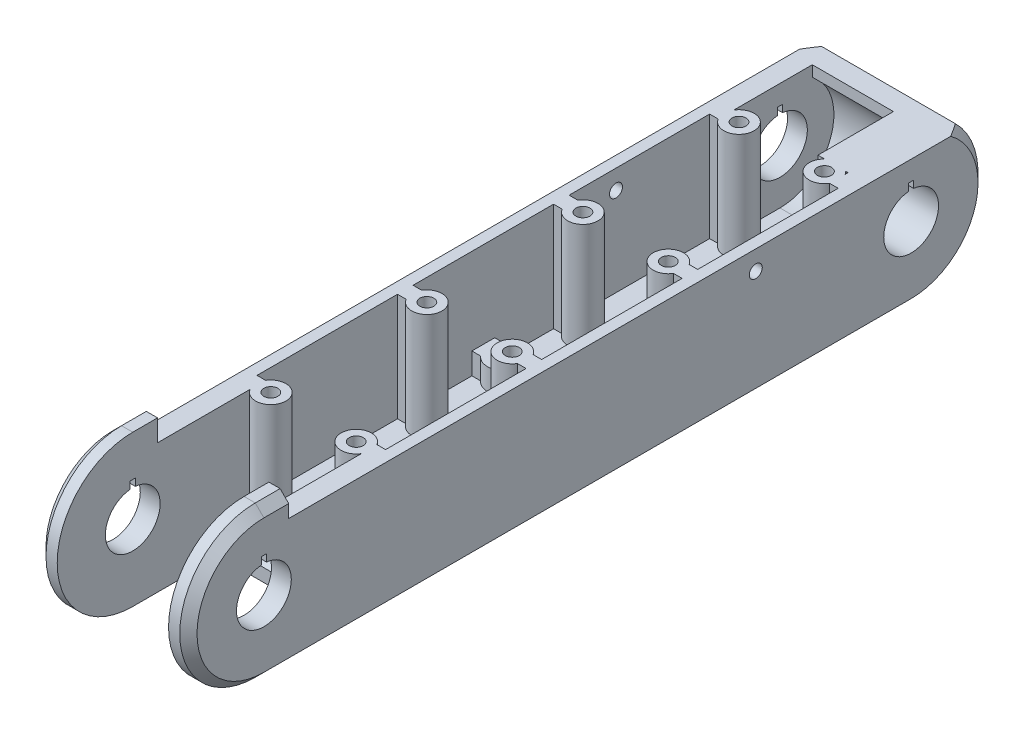
from build123d import *

# Parameters (mm, degrees)
SKETCH1_R           = 6.35
BOSS_EXTRUDE1_DEPTH = 17.5
CUT_EXTRUDE1_DEPTH  = 12.9
CHAMFER1_SIZE       = 2
SKETCH4_R           = 3.5
BOSS_EXTRUDE2_DEPTH = 25
SKETCH8_R           = 1.625
CUT_EXTRUDE4_DEPTH  = 30
SKETCH7_R           = 2.2
CUT_EXTRUDE3_DEPTH  = 4.5
SKETCH9_R           = 4
SKETCH9_R_2         = 1.625
BOSS_EXTRUDE3_DEPTH = 5
SKETCH11_R          = 2.75
CUT_EXTRUDE5_DEPTH  = 3
SKETCH12_R          = 1.625
CUT_EXTRUDE6_DEPTH  = 101.436547133
CUT_EXTRUDE8_REACH  = 100.805
SKETCH15_W          = 2
SKETCH15_H          = 32.561115391
SKETCH15_H_2        = 13.634806385
SKETCH16_W          = 2
SKETCH16_H          = 5.291502622
CUT_EXTRUDE9_DEPTH  = 20
CUT_EXTRUDE10_REACH = 102.437
SKETCH17_R          = 1.5
CUT_EXTRUDE11_REACH = 102.437
SKETCH18_W          = 1.2
SKETCH18_H          = 8
SKETCH19_W          = 20
SKETCH19_H          = 25
BOSS_EXTRUDE4_DEPTH = 7
CUT_EXTRUDE12_DEPTH = 35


with BuildPart() as part:
    # Sketch1 → Boss-Extrude1 (new, symmetric)
    with BuildSketch(Plane(origin=(0, 0, 0), x_dir=(0, 0, -1), z_dir=(1, 0, 0))):
        with BuildLine():
            Line((-75, -17.5), (75, -17.5))
            ThreePointArc((75, -17.5), (91.201851746, -6.614378278), (87.247448714, 12.5))
            Line((87.247448714, 12.5), (-69.247448714, 12.5))
            Line((-69.247448714, 12.5), (-69.247448714, 17.5))
            Line((-69.247448714, 17.5), (-75, 17.5))
            ThreePointArc((-75, 17.5), (-92.5, 0), (-75, -17.5))
        make_face()
        with Locations((-75, 0)):
            Circle(SKETCH1_R, mode=Mode.SUBTRACT)
        with Locations((75, 0)):
            Circle(SKETCH1_R, mode=Mode.SUBTRACT)
    extrude(amount=BOSS_EXTRUDE1_DEPTH, both=True)

    # Sketch3 → Cut-Extrude1 (cut, symmetric)
    with BuildSketch(Plane(origin=(0, 0, 0), x_dir=(0, 0, -1), z_dir=(1, 0, 0))):
        with BuildLine():
            Line((-55, -12.5), (75, -12.5))
            ThreePointArc((75, -12.5), (86.858541226, -3.952847075), (82.5, 10))
            Line((82.5, 10), (82.5, 17.5))
            Line((82.5, 17.5), (-92.5, 17.5))
            Line((-92.5, 17.5), (-92.5, -17.5))
            Line((-92.5, -17.5), (-55, -17.5))
            Line((-55, -17.5), (-55, -12.5))
        make_face()
    extrude(amount=CUT_EXTRUDE1_DEPTH, both=True, mode=Mode.SUBTRACT)

    # Chamfer1
    chamfer1_edges = [part.edges().sort_by_distance(p)[0] for p in [
        (17.5, -6.614378278, -91.201851746),
        (17.5, 17.5, 72.123724357),
        (0, -12.5, 55),
        (17.5, 0, 92.5),
        (-17.5, 17.5, 72.123724357),
        (-17.5, -6.614378278, -91.201851746),
        (-17.5, -17.5, 0),
        (-17.5, 0, 92.5),
        (17.5, -17.5, 0),
    ]]
    chamfer(chamfer1_edges, length=CHAMFER1_SIZE)

    # Sketch4 → Boss-Extrude2 (add)
    with BuildSketch(Plane(origin=(0, -12.5, 0), x_dir=(1, 0, 0), z_dir=(0, 1, 0))):
        with Locations((-9.9, 62.5)):
            Circle(SKETCH4_R)
        with Locations((-9.9, 26.333333333)):
            Circle(SKETCH4_R)
        with Locations((-9.9, -9.833333333)):
            Circle(SKETCH4_R)
        with Locations((-9.9, -46)):
            Circle(SKETCH4_R)
    boss_extrude2 = extrude(amount=BOSS_EXTRUDE2_DEPTH)

    # Sketch8 → Cut-Extrude4 (cut)
    with BuildSketch(Plane(origin=(0, 12.5, 0), x_dir=(1, 0, 0), z_dir=(0, 1, 0))):
        with Locations(Location((-9.9, 62.5, 0), (0, 0, 270))):
            Circle(SKETCH8_R)
        with Locations(Location((-9.9, 26.333333333, 0), (0, 0, 270))):
            Circle(SKETCH8_R)
        with Locations(Location((-9.9, -9.833333333, 0), (0, 0, 270))):
            Circle(SKETCH8_R)
        with Locations(Location((-9.9, -46, 0), (0, 0, 270))):
            Circle(SKETCH8_R)
    cut_extrude4 = extrude(amount=-CUT_EXTRUDE4_DEPTH, mode=Mode.SUBTRACT)

    # Sketch7 → Cut-Extrude3 (cut)
    with BuildSketch(Plane.XZ.offset(17.5)):
        with Locations(Location((-9.9, 46, 0), (0, 0, 270))):
            Circle(SKETCH7_R)
        with Locations(Location((-9.9, 9.833333333, 0), (0, 0, 270))):
            Circle(SKETCH7_R)
        with Locations(Location((-9.9, -26.333333333, 0), (0, 0, 270))):
            Circle(SKETCH7_R)
        with Locations(Location((-9.9, -62.5, 0), (0, 0, 270))):
            Circle(SKETCH7_R)
    cut_extrude3 = extrude(amount=-CUT_EXTRUDE3_DEPTH, mode=Mode.SUBTRACT)

    # Sketch9 → Boss-Extrude3 (add, symmetric)
    with BuildSketch(Plane(origin=(0, -12.5, 0), x_dir=(1, 0, 0), z_dir=(0, 1, 0))):
        with Locations((-9.9, 8.25)):
            Circle(SKETCH9_R)
        with Locations(Location((-9.9, 8.25, 0), (0, 0, 270))):
            Circle(SKETCH9_R_2, mode=Mode.SUBTRACT)
    boss_extrude3 = extrude(amount=BOSS_EXTRUDE3_DEPTH, both=True)

    # Sketch11 → Cut-Extrude5 (cut)
    with BuildSketch(Plane.XZ.offset(17.5)):
        with Locations(Location((-9.9, -8.25, 0), (0, 0, 270))):
            Circle(SKETCH11_R)
    cut_extrude5 = extrude(amount=-CUT_EXTRUDE5_DEPTH, mode=Mode.SUBTRACT)

    # Mirror1: Boss-Extrude2, Cut-Extrude4, Cut-Extrude3, Boss-Extrude3, Cut-Extrude5 across plane
    add(boss_extrude2.mirror(Plane(origin=(0, 0, 0), x_dir=(0, 0, 1), z_dir=(1, 0, 0))))
    add(cut_extrude4.mirror(Plane(origin=(0, 0, 0), x_dir=(0, 0, 1), z_dir=(1, 0, 0))), mode=Mode.SUBTRACT)
    add(cut_extrude3.mirror(Plane(origin=(0, 0, 0), x_dir=(0, 0, 1), z_dir=(1, 0, 0))), mode=Mode.SUBTRACT)
    add(boss_extrude3.mirror(Plane(origin=(0, 0, 0), x_dir=(0, 0, 1), z_dir=(1, 0, 0))))
    add(cut_extrude5.mirror(Plane(origin=(0, 0, 0), x_dir=(0, 0, 1), z_dir=(1, 0, 0))), mode=Mode.SUBTRACT)

    # Sketch12 → Cut-Extrude6 (cut, symmetric)
    with BuildSketch(Plane.XZ.offset(17.5)):
        with Locations(Location((9.9, -8.25, 0), (0, 0, 90))):
            Circle(SKETCH12_R)
    cut_extrude6 = extrude(amount=CUT_EXTRUDE6_DEPTH, both=True, mode=Mode.SUBTRACT)

    # Cut-Extrude8: up to this face of the body (flat: up to its plane)
    cut_extrude8_end = Plane(part.part.faces().sort_by_distance((0, -12.5, -11.369745073))[0])
    # Sketch15 → Cut-Extrude8 (cut, up to the picked face)
    with BuildSketch(Plane(origin=(0, 12.5, 0), x_dir=(1, 0, 0), z_dir=(0, 1, 0)), mode=Mode.PRIVATE) as cut_extrude8_sk1:
        with Locations((-13.9, 44.416666667)):
            Rectangle(SKETCH15_W, SKETCH15_H)
    cut_extrude8_tool1 = split(extrude(cut_extrude8_sk1.sketch, amount=-CUT_EXTRUDE8_REACH, mode=Mode.PRIVATE), bisect_by=cut_extrude8_end, keep=Keep.BOTH, mode=Mode.PRIVATE)
    # Sketch15 → Cut-Extrude8 (cut, up to the picked face)
    with BuildSketch(Plane(origin=(0, 12.5, 0), x_dir=(1, 0, 0), z_dir=(0, 1, 0)), mode=Mode.PRIVATE) as cut_extrude8_sk2:
        with Locations((-13.9, 17.713154504)):
            Rectangle(SKETCH15_W, SKETCH15_H_2)
    cut_extrude8_tool2 = split(extrude(cut_extrude8_sk2.sketch, amount=-CUT_EXTRUDE8_REACH, mode=Mode.PRIVATE), bisect_by=cut_extrude8_end, keep=Keep.BOTH, mode=Mode.PRIVATE)
    # Sketch15 → Cut-Extrude8 (cut, up to the picked face)
    with BuildSketch(Plane(origin=(0, 12.5, 0), x_dir=(1, 0, 0), z_dir=(0, 1, 0)), mode=Mode.PRIVATE) as cut_extrude8_sk3:
        with Locations((-13.9, -1.213154504)):
            Rectangle(SKETCH15_W, SKETCH15_H_2)
    cut_extrude8_tool3 = split(extrude(cut_extrude8_sk3.sketch, amount=-CUT_EXTRUDE8_REACH, mode=Mode.PRIVATE), bisect_by=cut_extrude8_end, keep=Keep.BOTH, mode=Mode.PRIVATE)
    # Sketch15 → Cut-Extrude8 (cut, up to the picked face)
    with BuildSketch(Plane(origin=(0, 12.5, 0), x_dir=(1, 0, 0), z_dir=(0, 1, 0)), mode=Mode.PRIVATE) as cut_extrude8_sk4:
        with Locations((-13.9, -27.916666666)):
            Rectangle(SKETCH15_W, SKETCH15_H)
    cut_extrude8_tool4 = split(extrude(cut_extrude8_sk4.sketch, amount=-CUT_EXTRUDE8_REACH, mode=Mode.PRIVATE), bisect_by=cut_extrude8_end, keep=Keep.BOTH, mode=Mode.PRIVATE)
    cut_extrude8_1 = cut_extrude8_tool1.solids().sort_by(Axis((-13.9, 12.5, -44.416667), (0, -1, 0)))[0]
    add(cut_extrude8_1, mode=Mode.SUBTRACT)
    cut_extrude8_2 = cut_extrude8_tool2.solids().sort_by(Axis((-13.9, 12.5, -17.713155), (0, -1, 0)))[0]
    add(cut_extrude8_2, mode=Mode.SUBTRACT)
    cut_extrude8_3 = cut_extrude8_tool3.solids().sort_by(Axis((-13.9, 12.5, 1.213155), (0, -1, 0)))[0]
    add(cut_extrude8_3, mode=Mode.SUBTRACT)
    cut_extrude8_4 = cut_extrude8_tool4.solids().sort_by(Axis((-13.9, 12.5, 27.916667), (0, -1, 0)))[0]
    add(cut_extrude8_4, mode=Mode.SUBTRACT)
    cut_extrude8 = cut_extrude8_1 + cut_extrude8_2 + cut_extrude8_3 + cut_extrude8_4  # Cut-Extrude8 as one shape, for the pattern or mirror that repeats it

    # Sketch16 → Cut-Extrude9 (cut)
    with BuildSketch(Plane(origin=(0, 12.5, 0), x_dir=(1, 0, 0), z_dir=(0, 1, 0))):
        with Locations((-13.9, 8.25)):
            Rectangle(SKETCH16_W, SKETCH16_H)
    cut_extrude9 = extrude(amount=-CUT_EXTRUDE9_DEPTH, mode=Mode.SUBTRACT)

    # Mirror2: Cut-Extrude6, Cut-Extrude8, Cut-Extrude9 across plane
    add(cut_extrude6.mirror(Plane(origin=(0, 0, 0), x_dir=(0, 0, 1), z_dir=(1, 0, 0))), mode=Mode.SUBTRACT)
    add(cut_extrude8.mirror(Plane(origin=(0, 0, 0), x_dir=(0, 0, 1), z_dir=(1, 0, 0))), mode=Mode.SUBTRACT)
    add(cut_extrude9.mirror(Plane(origin=(0, 0, 0), x_dir=(0, 0, 1), z_dir=(1, 0, 0))), mode=Mode.SUBTRACT)

    # Cut-Extrude10: up to this face of the body (flat: up to its plane)
    cut_extrude10_end = Plane(part.part.faces().sort_by_distance((-17.5, -1.343633732, 0.577395586))[0])
    # Sketch17 → Cut-Extrude10 (cut, up to the picked face)
    with BuildSketch(Plane(origin=(17.5, 0, 0), x_dir=(0, 0, -1), z_dir=(1, 0, 0)), mode=Mode.PRIVATE) as cut_extrude10_sk1:
        with Locations((39, 8)):
            Circle(SKETCH17_R)
    cut_extrude10_tool1 = split(extrude(cut_extrude10_sk1.sketch, amount=-CUT_EXTRUDE10_REACH, mode=Mode.PRIVATE), bisect_by=cut_extrude10_end, keep=Keep.BOTH, mode=Mode.PRIVATE)
    add(cut_extrude10_tool1.solids().sort_by(Axis((17.5, 8, -39), (-1, 0, 0)))[0], mode=Mode.SUBTRACT)

    # Cut-Extrude11: up to this face of the body (flat: up to its plane)
    cut_extrude11_end = Plane(part.part.faces().sort_by_distance((17.5, -1.35770743, 0.637008401))[0])
    # Sketch18 → Cut-Extrude11 (cut, up to the picked face)
    with BuildSketch(Plane.ZY.offset(17.5), mode=Mode.PRIVATE) as cut_extrude11_sk1:
        with Locations((-75, 4)):
            Rectangle(SKETCH18_W, SKETCH18_H)
    cut_extrude11_tool1 = split(extrude(cut_extrude11_sk1.sketch, amount=-CUT_EXTRUDE11_REACH, mode=Mode.PRIVATE), bisect_by=cut_extrude11_end, keep=Keep.BOTH, mode=Mode.PRIVATE)
    cut_extrude11 = cut_extrude11_tool1.solids().sort_by(Axis((-17.5, 4, -75), (1, 0, 0)))[0]
    add(cut_extrude11, mode=Mode.SUBTRACT)

    # Mirror3: Cut-Extrude11 across plane
    add(cut_extrude11.mirror(Plane.XY), mode=Mode.SUBTRACT)

    # Sketch19 → Boss-Extrude4 (add)
    with BuildSketch(Plane.ZY.offset(-12.9)):
        with Locations((-75, 0)):
            Rectangle(SKETCH19_W, SKETCH19_H)
    extrude(amount=BOSS_EXTRUDE4_DEPTH)

    # Sketch20 → Cut-Extrude12 (cut)
    with BuildSketch(Plane.ZY.offset(17.5)):
        with BuildLine():
            Line((-75.6, 6.32158999), (-75.6, 8))
            Line((-75.6, 8), (-74.4, 8))
            Line((-74.4, 8), (-74.4, 6.32158999))
            ThreePointArc((-74.4, 6.32158999), (-75, -6.35), (-75.6, 6.32158999))
        make_face()
    extrude(amount=-CUT_EXTRUDE12_DEPTH, mode=Mode.SUBTRACT)


solid = part.part
